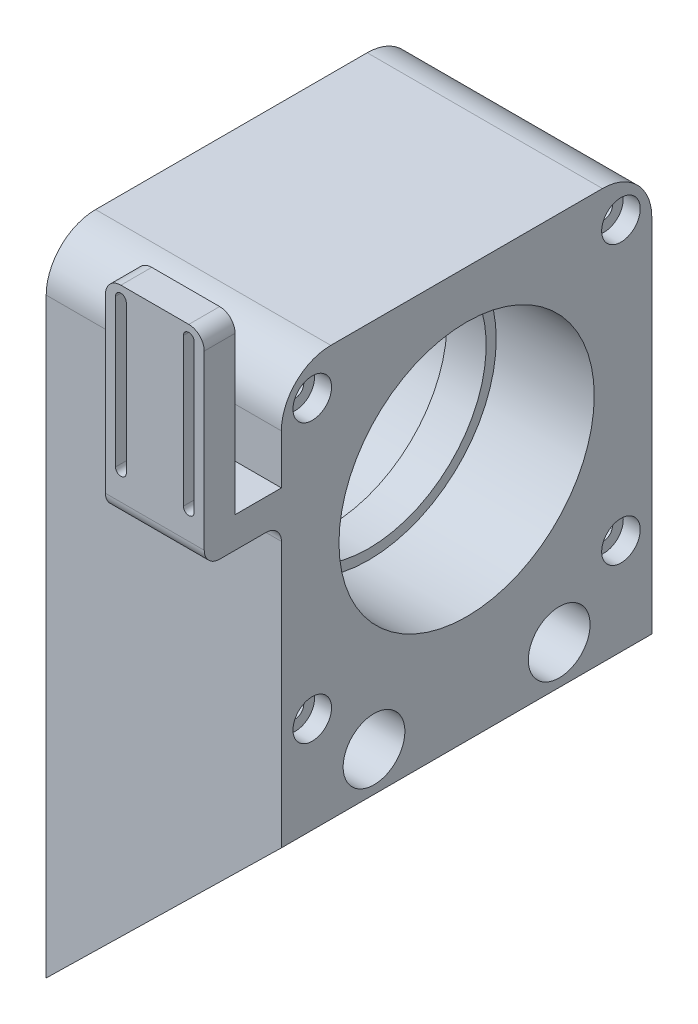
from build123d import *

# Parameters (mm, degrees)
BOSS_EXTRUDE1_DEPTH = 120
SKETCH3_R           = 4.25
CUT_EXTRUDE1_DEPTH  = 120
SKETCH5_R           = 10
CUT_EXTRUDE2_DEPTH  = 53
SKETCH6_R           = 4.25
CUT_EXTRUDE3_DEPTH  = 103
SKETCH7_W           = 76.2
SKETCH7_H           = 120
BOSS_EXTRUDE2_DEPTH = 101.6
SKETCH8_R           = 41.35
CUT_EXTRUDE4_DEPTH  = 31.75
CUT_EXTRUDE5_START  = -31.75
SKETCH9_R           = 41.35
CUT_EXTRUDE5_DEPTH  = 31.75
SKETCH10_R          = 38.1
CUT_EXTRUDE6_DEPTH  = 76.2
SKETCH13_W          = 76.2
SKETCH13_H          = 120
BOSS_EXTRUDE3_DEPTH = 6
CUT_EXTRUDE7_DEPTH  = 84.4
SKETCH12_R          = 6.25
CUT_EXTRUDE8_DEPTH  = 5.5
FILLET1_R           = 16
SKETCH18_W          = 32
SKETCH18_H          = 10
BOSS_EXTRUDE6_DEPTH = 15
BOSS_EXTRUDE7_DEPTH = 10
FILLET3_R           = 5


with BuildPart() as part:
    # Sketch1 → Boss-Extrude1 (new body)
    with BuildSketch(Plane.XY):
        Polygon((381, 457.2), (457.2, 457.2), (457.2, 431.8), (381, 357.2), align=None)
    extrude(amount=BOSS_EXTRUDE1_DEPTH)

    # Sketch3 → Cut-Extrude1 (cut)
    with BuildSketch(Plane(origin=(457.2, 0, 0), x_dir=(0, 0, -1), z_dir=(1, 0, 0))):
        with Locations(Location((-90, 394.5, 0), (0, 0, 90))):
            Circle(SKETCH3_R)
        with Locations(Location((-30, 394.5, 0), (0, 0, 90))):
            Circle(SKETCH3_R)
    extrude(amount=-CUT_EXTRUDE1_DEPTH, mode=Mode.SUBTRACT)

    # Sketch5 → Cut-Extrude2 (cut)
    with BuildSketch(Plane(origin=(457.2, 0, 0), x_dir=(0, 0, -1), z_dir=(1, 0, 0))):
        with Locations(Location((-90, 394.5, 0), (0, 0, 90))):
            Circle(SKETCH5_R)
        with Locations(Location((-30, 394.5, 0), (0, 0, 90))):
            Circle(SKETCH5_R)
        with Locations(Location((-90, 444.5, 0), (0, 0, 90))):
            Circle(SKETCH5_R)
        with Locations(Location((-30, 444.5, 0), (0, 0, 90))):
            Circle(SKETCH5_R)
    extrude(amount=-CUT_EXTRUDE2_DEPTH, mode=Mode.SUBTRACT)

    # Sketch6 → Cut-Extrude3 (cut)
    with BuildSketch(Plane(origin=(457.2, 0, 0), x_dir=(0, 0, -1), z_dir=(1, 0, 0))):
        with Locations(Location((-90, 444.5, 0), (0, 0, 90))):
            Circle(SKETCH6_R)
        with Locations(Location((-30, 444.5, 0), (0, 0, 90))):
            Circle(SKETCH6_R)
    extrude(amount=-CUT_EXTRUDE3_DEPTH, mode=Mode.SUBTRACT)

    # Sketch7 → Boss-Extrude2 (add)
    with BuildSketch(Plane(origin=(0, 457.2, 0), x_dir=(1, 0, 0), z_dir=(0, 1, 0))):
        with Locations((419.1, -60)):
            Rectangle(SKETCH7_W, SKETCH7_H)
    extrude(amount=BOSS_EXTRUDE2_DEPTH)

    # Sketch8 → Cut-Extrude4 (cut)
    with BuildSketch(Plane.ZY.offset(-381)):
        with Locations((60, 508)):
            Circle(SKETCH8_R)
    extrude(amount=-CUT_EXTRUDE4_DEPTH, mode=Mode.SUBTRACT)

    # Sketch9 → Cut-Extrude5 (cut)
    with BuildSketch(Plane(origin=(457.2, 0, 0), x_dir=(0, 0, -1), z_dir=(1, 0, 0)).offset(CUT_EXTRUDE5_START)):
        with Locations(Location((-60, 508, 0), (0, 0, 180))):
            Circle(SKETCH9_R)
    extrude(amount=CUT_EXTRUDE5_DEPTH, mode=Mode.SUBTRACT)

    # Sketch10 → Cut-Extrude6 (cut)
    with BuildSketch(Plane(origin=(457.2, 0, 0), x_dir=(0, 0, -1), z_dir=(1, 0, 0))):
        with Locations(Location((-60, 508, 0), (0, 0, 90))):
            Circle(SKETCH10_R)
    extrude(amount=-CUT_EXTRUDE6_DEPTH, mode=Mode.SUBTRACT)

    # Sketch13 → Boss-Extrude3 (add)
    with BuildSketch(Plane(origin=(0, 558.8, 0), x_dir=(1, 0, 0), z_dir=(0, 1, 0))):
        with Locations((419.1, -60)):
            Rectangle(SKETCH13_W, SKETCH13_H)
    extrude(amount=BOSS_EXTRUDE3_DEPTH)

    # Sketch11 → Cut-Extrude7 (cut)
    with BuildSketch(Plane(origin=(457.2, 0, 0), x_dir=(0, 0, -1), z_dir=(1, 0, 0))):
        with BuildLine():
            Line((-110, 550.25), (-110, 553))
            Line((-110, 553), (-107.25, 553))
            ThreePointArc((-107.25, 553), (-111.944543648, 554.944543648), (-110, 550.25))
        make_face()
        with BuildLine():
            Line((-107.25, 553), (-110, 553))
            Line((-110, 553), (-110, 550.25))
            ThreePointArc((-110, 550.25), (-108.055456352, 551.055456352), (-107.25, 553))
        make_face()
        with BuildLine():
            ThreePointArc((-7.25, 553), (-10, 555.75), (-12.75, 553))
            Line((-12.75, 553), (-10, 553))
            Line((-10, 553), (-10, 550.25))
            ThreePointArc((-10, 550.25), (-8.055456352, 551.055456352), (-7.25, 553))
        make_face()
        with BuildLine():
            Line((-10, 553), (-12.75, 553))
            ThreePointArc((-12.75, 553), (-11.944543648, 551.055456352), (-10, 550.25))
            Line((-10, 550.25), (-10, 553))
        make_face()
        with BuildLine():
            ThreePointArc((-7.25, 463), (-8.055456352, 464.944543648), (-10, 465.75))
            Line((-10, 465.75), (-10, 463))
            Line((-10, 463), (-12.75, 463))
            ThreePointArc((-12.75, 463), (-10, 460.25), (-7.25, 463))
        make_face()
        with BuildLine():
            Line((-10, 463), (-10, 465.75))
            ThreePointArc((-10, 465.75), (-11.944543648, 464.944543648), (-12.75, 463))
            Line((-12.75, 463), (-10, 463))
        make_face()
        with BuildLine():
            ThreePointArc((-107.25, 463), (-108.055456352, 464.944543648), (-110, 465.75))
            Line((-110, 465.75), (-110, 463))
            Line((-110, 463), (-107.25, 463))
        make_face()
        with BuildLine():
            Line((-110, 463), (-110, 465.75))
            ThreePointArc((-110, 465.75), (-111.944543648, 461.055456352), (-107.25, 463))
            Line((-107.25, 463), (-110, 463))
        make_face()
    extrude(amount=-CUT_EXTRUDE7_DEPTH, mode=Mode.SUBTRACT)

    # Sketch12 → Cut-Extrude8 (cut)
    with BuildSketch(Plane(origin=(457.2, 0, 0), x_dir=(0, 0, -1), z_dir=(1, 0, 0))):
        with Locations((-110, 553)):
            Circle(SKETCH12_R)
        with Locations((-10, 553)):
            Circle(SKETCH12_R)
        with Locations((-10, 463)):
            Circle(SKETCH12_R)
        with Locations((-110, 463)):
            Circle(SKETCH12_R)
    extrude(amount=-CUT_EXTRUDE8_DEPTH, mode=Mode.SUBTRACT)

    # Fillet1
    fillet1_edges = [part.edges().sort_by_distance(p)[0] for p in [
        (419.1, 564.8, 120),
        (419.1, 564.8, 0),
    ]]
    fillet(fillet1_edges, radius=FILLET1_R)

    # Sketch18 → Boss-Extrude6 (add)
    with BuildSketch(Plane.XY.offset(120)):
        with Locations((441.2, 527.8)):
            Rectangle(SKETCH18_W, SKETCH18_H)
    extrude(amount=BOSS_EXTRUDE6_DEPTH)

    # Sketch20 → Boss-Extrude7 (add)
    with BuildSketch(Plane.XY.offset(135)):
        Polygon((425.2, 588.682542047), (425.2, 532.8), (425.2, 522.8), (457.2, 522.8), (457.2, 536.682542047), (457.2, 588.682542047), align=None)
        with BuildLine():
            ThreePointArc((428.45, 584.682542047), (430.2, 586.432542047), (431.95, 584.682542047))
            Line((431.95, 584.682542047), (431.95, 536.8))
            ThreePointArc((431.95, 536.8), (430.2, 535.05), (428.45, 536.8))
            Line((428.45, 536.8), (428.45, 584.682542047))
        make_face(mode=Mode.SUBTRACT)
        with BuildLine():
            Line((450.45, 536.8), (450.45, 584.682542047))
            ThreePointArc((450.45, 584.682542047), (452.2, 586.432542047), (453.95, 584.682542047))
            Line((453.95, 584.682542047), (453.95, 536.8))
            ThreePointArc((453.95, 536.8), (452.2, 535.05), (450.45, 536.8))
        make_face(mode=Mode.SUBTRACT)
    extrude(amount=BOSS_EXTRUDE7_DEPTH)

    # Fillet3
    fillet3_edges = [part.edges().sort_by_distance(p)[0] for p in [
        (441.2, 522.8, 120),
        (425.2, 588.682542047, 140),
        (457.2, 588.682542047, 140),
        (441.2, 522.8, 145),
    ]]
    fillet(fillet3_edges, radius=FILLET3_R)


solid = part.part
